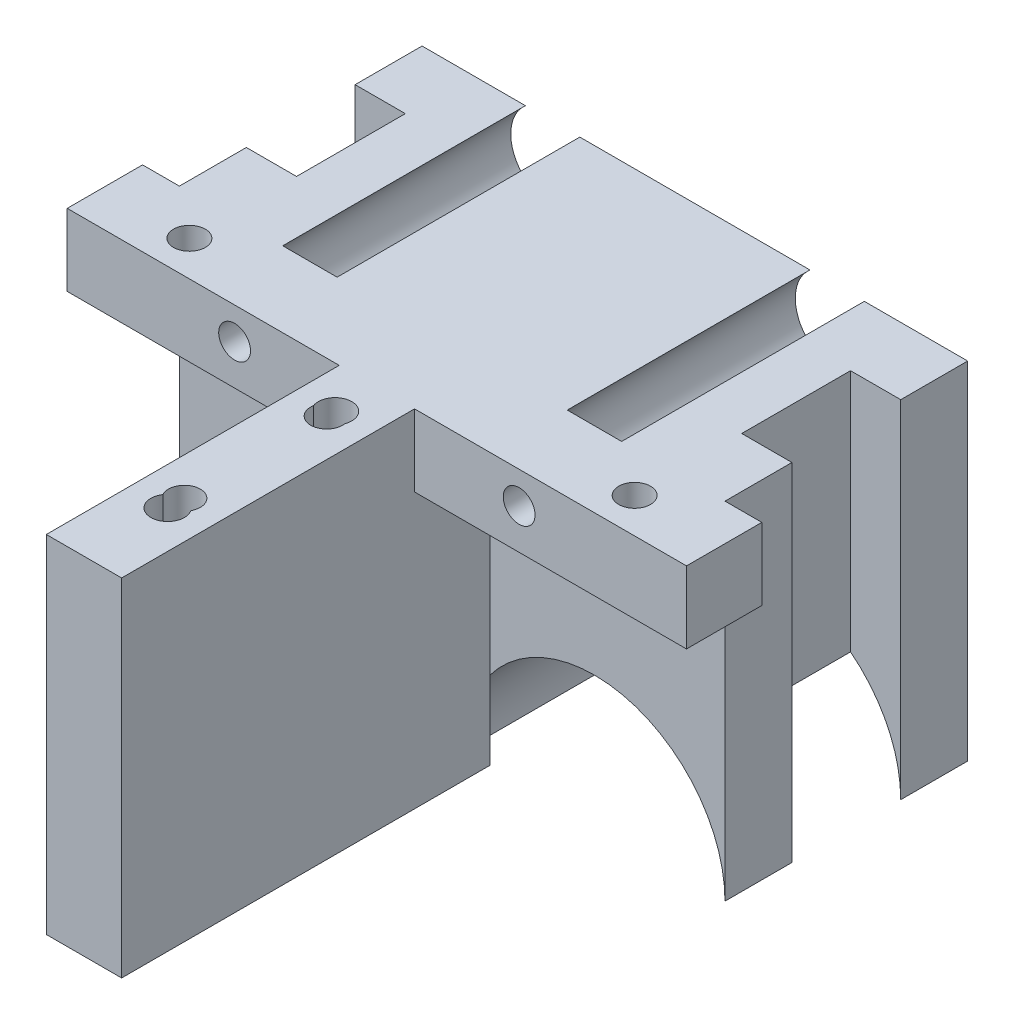
from build123d import *

# Parameters (mm, degrees)
SKETCH_1_W           = 37
SKETCH_1_H           = 4.8
SKETCH_1_R           = 0.95
EXTRUDE_1_DEPTH      = 4
EXTRUDE_2_DEPTH      = 21.2
SKETCH_8_W           = 4.5
SKETCH_8_H           = 4.8
EXTRUDE_4_DEPTH      = 8
SKETCH_12_R          = 7.8
CUT_EXTRUDE_3_DEPTH  = 14.5
EXTRUDE_6_DEPTH      = 16.4
EXTRUDE_6_DEPTH_BACK = 4.8
SKETCH_13_W          = 4.5
SKETCH_13_H          = 22
SKETCH_15_R          = 2.5
CUT_EXTRUDE_4_DEPTH  = 14.5
SKETCH_16_W          = 37
SKETCH_16_H          = 4.8
SKETCH_16_R          = 0.95
EXTRUDE_8_DEPTH      = 0.5
SKETCH_19_R          = 0.95
CUT_EXTRUDE_5_DEPTH  = 30
SKETCH_21_W          = 37
SKETCH_21_H          = 0.5
CUT_EXTRUDE_6_DEPTH  = 57.131007474
SKETCH_24_R          = 1
CUT_EXTRUDE_7_DEPTH  = 30
SKETCH_25_R          = 0.95
CUT_EXTRUDE_8_DEPTH  = 10
SKETCH_27_R          = 2
CUT_EXTRUDE_9_DEPTH  = 2


with BuildPart() as part:
    # 草图1 → 凸台-拉伸1 (new body)
    with BuildSketch(Plane.XY):
        with Locations((18.5, -2.4)):
            Rectangle(SKETCH_1_W, SKETCH_1_H)
        with Locations((10, -2.4)):
            Circle(SKETCH_1_R, mode=Mode.SUBTRACT)
        with Locations((27, -2.4)):
            Circle(SKETCH_1_R, mode=Mode.SUBTRACT)
    extrude(amount=EXTRUDE_1_DEPTH)

    # 草图4 → 凸台-拉伸2 (add)
    with BuildSketch(Plane(origin=(0, 0, 0), x_dir=(1, 0, 0), z_dir=(0, 1, 0))):
        Polygon((2.2, 0), (2.2, 4), (5.2, 4), (5.2, 10.5), (2.2, 10.5), (2.2, 14.5), (34.8, 14.5), (34.8, 10.5), (31.8, 10.5), (31.8, 4), (34.8, 4), (34.8, 0), align=None)
    extrude(amount=-EXTRUDE_2_DEPTH)

    # 草图8 → 凸台-拉伸4 (add)
    with BuildSketch(Plane.XY.offset(4)):
        with Locations((18.5, -2.4)):
            Rectangle(SKETCH_8_W, SKETCH_8_H)
    extrude(amount=EXTRUDE_4_DEPTH)

    # 草图12 → 切除-拉伸3 (cut)
    with BuildSketch(Plane.XY):
        with Locations((10, -21.2)):
            Circle(SKETCH_12_R)
        with Locations((27, -21.2)):
            Circle(SKETCH_12_R)
    extrude(amount=-CUT_EXTRUDE_3_DEPTH, mode=Mode.SUBTRACT)

    # 草图13 → 凸台-拉伸6 (add, two sides: drawn at the far end of the back side and taken through both)
    with BuildSketch(Plane.XZ.offset(4.8).offset(-EXTRUDE_6_DEPTH_BACK)):
        with Locations((18.5, 11)):
            Rectangle(SKETCH_13_W, SKETCH_13_H)
    extrude(amount=EXTRUDE_6_DEPTH + EXTRUDE_6_DEPTH_BACK)

    # 草图15 → 切除-拉伸4 (cut)
    with BuildSketch(Plane.XY):
        with Locations((10, -2.4)):
            Circle(SKETCH_15_R)
        with Locations((27, -2.4)):
            Circle(SKETCH_15_R)
    extrude(amount=-CUT_EXTRUDE_4_DEPTH, mode=Mode.SUBTRACT)

    # 草图16 → 凸台-拉伸8 (add)
    with BuildSketch(Plane.XY.offset(4)):
        with Locations((18.5, -2.4)):
            Rectangle(SKETCH_16_W, SKETCH_16_H)
        with Locations((10, -2.4)):
            Circle(SKETCH_16_R, mode=Mode.SUBTRACT)
        with Locations((27, -2.4)):
            Circle(SKETCH_16_R, mode=Mode.SUBTRACT)
    extrude(amount=EXTRUDE_8_DEPTH)

    # 草图19 → 切除-拉伸5 (cut)
    with BuildSketch(Plane.XZ.offset(21.2)):
        with Locations(Location((18.5, 7.5, 0), (0, 0, 270))):
            Circle(SKETCH_19_R)
        with Locations(Location((18.5, 16, 0), (0, 0, 270))):
            Circle(SKETCH_19_R)
    extrude(amount=-CUT_EXTRUDE_5_DEPTH, mode=Mode.SUBTRACT)

    # 草图21 → 切除-拉伸6 (cut, through all)
    with BuildSketch(Plane(origin=(0, 0, -14.5), x_dir=(-1, 0, 0), z_dir=(0, 0, -1))):
        with Locations((-18.5, -0.25)):
            Rectangle(SKETCH_21_W, SKETCH_21_H)
    extrude(amount=-CUT_EXTRUDE_6_DEPTH, mode=Mode.SUBTRACT)

    # 草图24 → 切除-拉伸7 (cut)
    with BuildSketch(Plane(origin=(0, -0.5, 0), x_dir=(1, 0, 0), z_dir=(0, 1, 0))):
        with Locations((18.5, -17)):
            Circle(SKETCH_24_R)
        with Locations((18.5, -7)):
            Circle(SKETCH_24_R)
    extrude(amount=-CUT_EXTRUDE_7_DEPTH, mode=Mode.SUBTRACT)

    # 草图25 → 切除-拉伸8 (cut)
    with BuildSketch(Plane.XZ.offset(4.8)):
        with Locations((5.2, 2.4)):
            Circle(SKETCH_25_R)
        with Locations((31.8, 2.4)):
            Circle(SKETCH_25_R)
    extrude(amount=-CUT_EXTRUDE_8_DEPTH, mode=Mode.SUBTRACT)

    # 草图27 → 切除-拉伸9 (cut)
    with BuildSketch(Plane(origin=(0, -4.8, 0), x_dir=(-1, 0, 0), z_dir=(0, -1, 0))):
        with Locations(Location((-5.2, -2.4, 0), (0, 0, 90))):
            Circle(SKETCH_27_R)
        with Locations(Location((-31.8, -2.4, 0), (0, 0, 90))):
            Circle(SKETCH_27_R)
    extrude(amount=-CUT_EXTRUDE_9_DEPTH, mode=Mode.SUBTRACT)


solid = part.part
